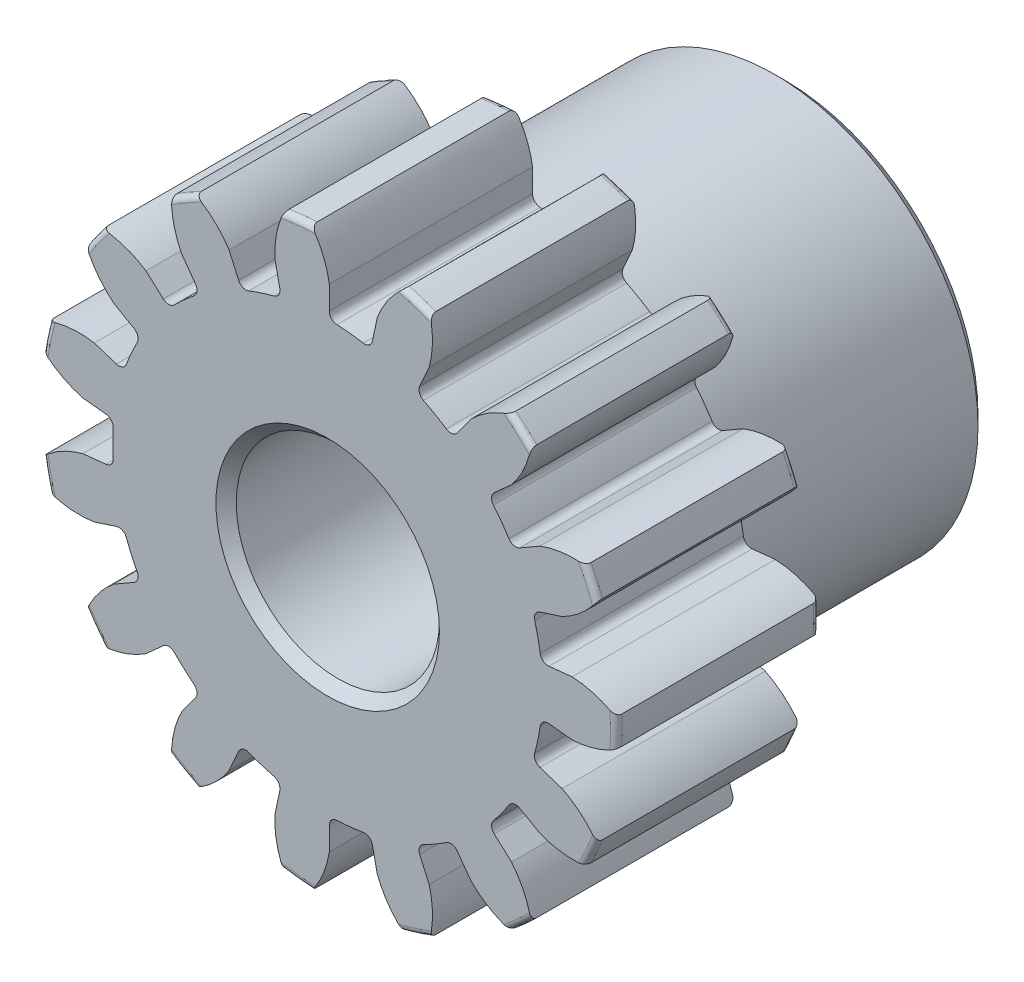
from build123d import *

# Parameters (mm, degrees)
SKETCH1_R                = 9.017
BOSS_EXTRUDE1_DEPTH      = 6.35
SKETCH2_W                = 7.9375
SKETCH2_H                = 6.35
FILLET2_R                = 0.18034
CUT_EXTRUDE1_DEPTH       = 20.150593669
FILLET1_R                = 0.2493645
CIRPATTERN1_COUNT        = 15
FILLET1_OF_CIRPATTERN1_R = 0.2493645
SKETCH5_R                = 3.175
CUT_EXTRUDE2_DEPTH       = 20.143922925
CHAMFER1_SIZE            = 0.3175


with BuildPart() as part:
    # Sketch1 → Boss-Extrude1 (new body)
    with BuildSketch(Plane.XY):
        Circle(SKETCH1_R)
    extrude(amount=-BOSS_EXTRUDE1_DEPTH)

    # Sketch2 → Revolve1 (revolve)
    with BuildSketch(Plane(origin=(0, 0, 0), x_dir=(0, 0, -1), z_dir=(1, 0, 0)), mode=Mode.PRIVATE) as revolve1_sk:
        with Locations((10.31875, 3.175)):
            Rectangle(SKETCH2_W, SKETCH2_H)
    revolve(revolve1_sk.sketch.rotate(Axis((0, 0, -6.35), (0, 0, -1)), 90), axis=Axis((0, 0, -6.35), (0, 0, -1)))

    # Fillet2
    fillet2_edges = [part.edges().sort_by_distance(p)[0] for p in [
        (-9.017, 0, 0),
        (-9.017, 0, -6.35),
        (-6.35, 0, -6.35),
    ]]
    fillet(fillet2_edges, radius=FILLET2_R)

    # Sketch4 → Cut-Extrude1 (cut, through all)
    with BuildSketch(Plane.XY):
        with BuildLine():
            Line((0.049942926, 7.684509603), (0.049942926, 6.71282255))
            ThreePointArc((0.049942926, 6.71282255), (0.70170208, 6.676233599), (1.346825954, 6.57651433))
            Line((1.346825954, 6.57651433), (1.548851518, 7.526967591))
            add(Edge.make_bspline(
                [(2.597714995, 8.888542846), (1.853997728, 8.336224151), (1.548851518, 7.526967591)],
                knots=[0, 0, 0, 1, 1, 1], degree=2))
            ThreePointArc((2.597714995, 8.888542846), (0.967973736, 9.209633215), (-0.692912195, 9.234402515))
            add(Edge.make_bspline(
                [(-0.692912195, 9.234402515), (-0.080280789, 8.539525494), (0.049942926, 7.684509603)],
                knots=[0, 0, 0, 1, 1, 1], degree=2))
        make_face()
    cut_extrude1 = extrude(amount=-CUT_EXTRUDE1_DEPTH, mode=Mode.SUBTRACT)

    # Fillet1
    fillet1_edges = [part.edges().sort_by_distance(p)[0] for p in [
        (1.346825954, 6.57651433, -3.175),
        (0.049942926, 6.71282255, -3.175),
    ]]
    fillet(fillet1_edges, radius=FILLET1_R)

    # CirPattern1: Cut-Extrude1 ×15 about axis
    cirpattern1_axis = Axis((0, 0, -6.35), (0, 0, 1))
    for i in range(1, CIRPATTERN1_COUNT):
        add(cut_extrude1.rotate(cirpattern1_axis, i * 360 / CIRPATTERN1_COUNT), mode=Mode.SUBTRACT)

    # Fillet1 of CirPattern1
    fillet1_of_cirpattern1_edges = [part.edges().sort_by_distance(p)[0] for p in [
        (-1.444522629, 6.555748261, -3.175),
        (-2.684725776, 6.152782167, -3.175),
        (-3.986100127, 5.40143376, -3.175),
        (-4.955181002, 4.52886985, -3.175),
        (-5.8384447, 3.313162292, -3.175),
        (-6.368840416, 2.121874793, -3.175),
        (-6.681269144, 0.652014964, -3.175),
        (-6.681269463, -0.652011692, -3.175),
        (-6.368841455, -2.121871674, -3.175),
        (-5.838446322, -3.313159432, -3.175),
        (-4.95518322, -4.528867423, -3.175),
        (-3.986102772, -5.401431808, -3.175),
        (-2.68472879, -6.152780852, -3.175),
        (-1.44452584, -6.555747553, -3.175),
        (0.049939638, -6.712822574, -3.175),
        (1.346822733, -6.57651499, -3.175),
        (2.775973049, -6.11215629, -3.175),
        (3.90529342, -5.460143239, -3.175),
        (5.022015501, -4.454642656, -3.175),
        (5.788503396, -3.399663118, -3.175),
        (6.399705849, -2.026880837, -3.175),
        (6.670828548, -0.751350359, -3.175),
        (6.670828916, 0.751347092, -3.175),
        (6.399706842, 2.026877703, -3.175),
        (5.788505061, 3.399660283, -3.175),
        (5.022017683, 4.454640196, -3.175),
        (3.905296094, 5.460141326, -3.175),
        (2.775976043, 6.11215493, -3.175),
    ]]
    fillet(fillet1_of_cirpattern1_edges, radius=FILLET1_OF_CIRPATTERN1_R)

    # Sketch5 → Cut-Extrude2 (cut, through all)
    with BuildSketch(Plane.XY):
        Circle(SKETCH5_R)
    extrude(amount=-CUT_EXTRUDE2_DEPTH, mode=Mode.SUBTRACT)

    # Chamfer1
    chamfer1_edges = [part.edges().sort_by_distance(p)[0] for p in [
        (-6.35, 0, -14.2875),
        (-3.175, 0, -14.2875),
        (-3.175, 0, 0),
    ]]
    chamfer(chamfer1_edges, length=CHAMFER1_SIZE)


solid = part.part
